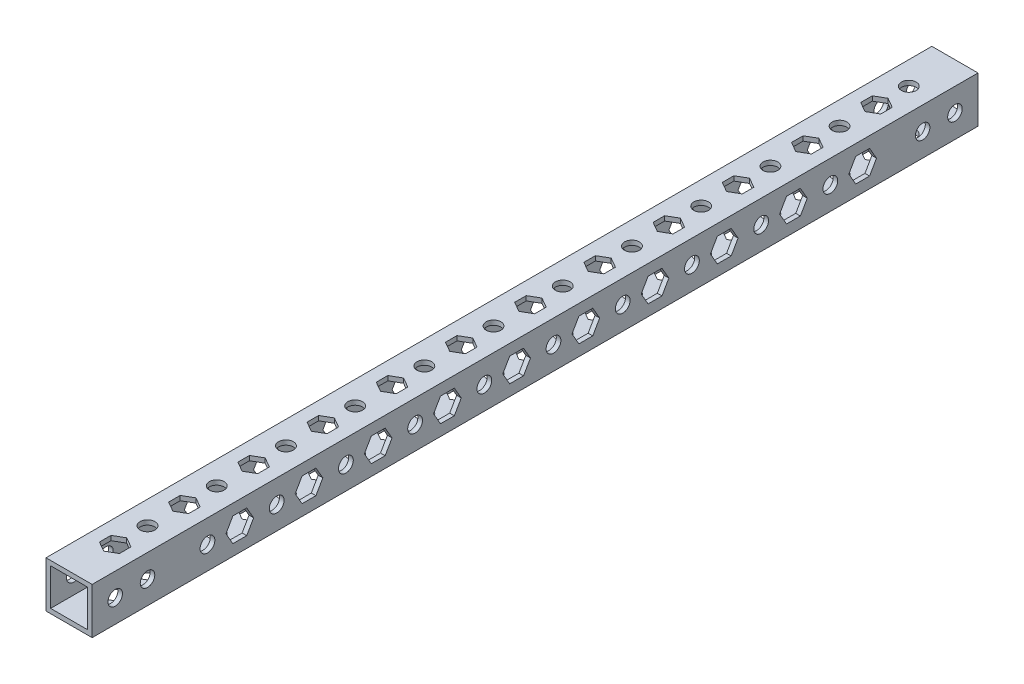
from build123d import *

# Parameters (mm, degrees)
SKETCH_1_W          = 10
SKETCH_1_H          = 10
SKETCH_1_W_2        = 8
SKETCH_1_H_2        = 8
EXTRUDE_1_DEPTH     = 192
SKETCH_2_R          = 1.575
SKETCH_2_R_2        = 1.6
CUT_EXTRUDE_1_DEPTH = 193.520128818
SKETCH_3_R          = 1.6
CUT_EXTRUDE_2_DEPTH = 193.520128818


with BuildPart() as part:
    # 草图1 → 拉伸-薄壁1 (new body)
    with BuildSketch(Plane.XY):
        with Locations((5, -5)):
            Rectangle(SKETCH_1_W, SKETCH_1_H)
        with Locations((5, -5)):
            Rectangle(SKETCH_1_W_2, SKETCH_1_H_2, mode=Mode.SUBTRACT)
    extrude(amount=EXTRUDE_1_DEPTH)

    # 草图2 → 切除-拉伸1 (cut, through all)
    with BuildSketch(Plane(origin=(10, 0, 0), x_dir=(0, 0, -1), z_dir=(1, 0, 0))):
        with Locations((-5, -5)):
            Circle(SKETCH_2_R)
        with Locations(Location((-187, -5, 0), (0, 0, 180))):
            Circle(SKETCH_2_R)
        with Locations((-12, -5)):
            Circle(SKETCH_2_R)
        with Locations(Location((-180, -5, 0), (0, 0, 180))):
            Circle(SKETCH_2_R)
        with Locations((-167, -5)):
            Circle(SKETCH_2_R_2)
        with Locations((-152, -5)):
            Circle(SKETCH_2_R_2)
        with Locations((-137, -5)):
            Circle(SKETCH_2_R_2)
        with Locations((-122, -5)):
            Circle(SKETCH_2_R_2)
        with Locations((-107, -5)):
            Circle(SKETCH_2_R_2)
        with Locations((-92, -5)):
            Circle(SKETCH_2_R_2)
        with Locations((-77, -5)):
            Circle(SKETCH_2_R_2)
        with Locations((-62, -5)):
            Circle(SKETCH_2_R_2)
        with Locations((-47, -5)):
            Circle(SKETCH_2_R_2)
        with Locations((-32, -5)):
            Circle(SKETCH_2_R_2)
        Polygon((-143.5, -2.401923789), (-146.5, -2.401923789), (-148, -5), (-146.5, -7.598076211), (-143.5, -7.598076211), (-142, -5), align=None)
        Polygon((-157, -5), (-158.5, -2.401923789), (-161.5, -2.401923789), (-163, -5), (-161.5, -7.598076211), (-158.5, -7.598076211), align=None)
        Polygon((-128.5, -2.401923789), (-131.5, -2.401923789), (-133, -5), (-131.5, -7.598076211), (-128.5, -7.598076211), (-127, -5), align=None)
        Polygon((-113.5, -2.401923789), (-116.5, -2.401923789), (-118, -5), (-116.5, -7.598076211), (-113.5, -7.598076211), (-112, -5), align=None)
        Polygon((-98.5, -2.401923789), (-101.5, -2.401923789), (-103, -5), (-101.5, -7.598076211), (-98.5, -7.598076211), (-97, -5), align=None)
        Polygon((-83.5, -2.401923789), (-86.5, -2.401923789), (-88, -5), (-86.5, -7.598076211), (-83.5, -7.598076211), (-82, -5), align=None)
        Polygon((-68.5, -2.401923789), (-71.5, -2.401923789), (-73, -5), (-71.5, -7.598076211), (-68.5, -7.598076211), (-67, -5), align=None)
        Polygon((-53.5, -2.401923789), (-56.5, -2.401923789), (-58, -5), (-56.5, -7.598076211), (-53.5, -7.598076211), (-52, -5), align=None)
        Polygon((-38.5, -2.401923789), (-41.5, -2.401923789), (-43, -5), (-41.5, -7.598076211), (-38.5, -7.598076211), (-37, -5), align=None)
        Polygon((-23.5, -2.401923789), (-26.5, -2.401923789), (-28, -5), (-26.5, -7.598076211), (-23.5, -7.598076211), (-22, -5), align=None)
    extrude(amount=-CUT_EXTRUDE_1_DEPTH, mode=Mode.SUBTRACT)

    # 草图3 → 切除-拉伸2 (cut, through all)
    with BuildSketch(Plane(origin=(0, 0, 0), x_dir=(1, 0, 0), z_dir=(0, 1, 0))):
        with Locations(Location((5, -10, 0), (0, 0, 270))):
            Circle(SKETCH_3_R)
        with Locations(Location((5, -25, 0), (0, 0, 270))):
            Circle(SKETCH_3_R)
        with Locations(Location((5, -40, 0), (0, 0, 270))):
            Circle(SKETCH_3_R)
        with Locations(Location((5, -55, 0), (0, 0, 270))):
            Circle(SKETCH_3_R)
        with Locations(Location((5, -70, 0), (0, 0, 270))):
            Circle(SKETCH_3_R)
        with Locations(Location((5, -85, 0), (0, 0, 270))):
            Circle(SKETCH_3_R)
        with Locations(Location((5, -100, 0), (0, 0, 270))):
            Circle(SKETCH_3_R)
        with Locations(Location((5, -115, 0), (0, 0, 270))):
            Circle(SKETCH_3_R)
        with Locations(Location((5, -130, 0), (0, 0, 270))):
            Circle(SKETCH_3_R)
        with Locations(Location((5, -145, 0), (0, 0, 270))):
            Circle(SKETCH_3_R)
        with Locations(Location((5, -160, 0), (0, 0, 270))):
            Circle(SKETCH_3_R)
        with Locations(Location((5, -175, 0), (0, 0, 270))):
            Circle(SKETCH_3_R)
        Polygon((7.165063509, -30.75), (5, -29.5), (2.834936491, -30.75), (2.834936491, -33.25), (5, -34.5), (7.165063509, -33.25), align=None)
        Polygon((5, -14.5), (2.834936491, -15.75), (2.834936491, -18.25), (5, -19.5), (7.165063509, -18.25), (7.165063509, -15.75), align=None)
        Polygon((7.165063509, -45.75), (5, -44.5), (2.834936491, -45.75), (2.834936491, -48.25), (5, -49.5), (7.165063509, -48.25), align=None)
        Polygon((7.165063509, -60.75), (5, -59.5), (2.834936491, -60.75), (2.834936491, -63.25), (5, -64.5), (7.165063509, -63.25), align=None)
        Polygon((7.165063509, -75.75), (5, -74.5), (2.834936491, -75.75), (2.834936491, -78.25), (5, -79.5), (7.165063509, -78.25), align=None)
        Polygon((7.165063509, -90.75), (5, -89.5), (2.834936491, -90.75), (2.834936491, -93.25), (5, -94.5), (7.165063509, -93.25), align=None)
        Polygon((7.165063509, -105.75), (5, -104.5), (2.834936491, -105.75), (2.834936491, -108.25), (5, -109.5), (7.165063509, -108.25), align=None)
        Polygon((7.165063509, -120.75), (5, -119.5), (2.834936491, -120.75), (2.834936491, -123.25), (5, -124.5), (7.165063509, -123.25), align=None)
        Polygon((7.165063509, -135.75), (5, -134.5), (2.834936491, -135.75), (2.834936491, -138.25), (5, -139.5), (7.165063509, -138.25), align=None)
        Polygon((7.165063509, -150.75), (5, -149.5), (2.834936491, -150.75), (2.834936491, -153.25), (5, -154.5), (7.165063509, -153.25), align=None)
        Polygon((7.165063509, -165.75), (5, -164.5), (2.834936491, -165.75), (2.834936491, -168.25), (5, -169.5), (7.165063509, -168.25), align=None)
        Polygon((7.165063509, -180.75), (5, -179.5), (2.834936491, -180.75), (2.834936491, -183.25), (5, -184.5), (7.165063509, -183.25), align=None)
    extrude(amount=-CUT_EXTRUDE_2_DEPTH, mode=Mode.SUBTRACT)


solid = part.part
